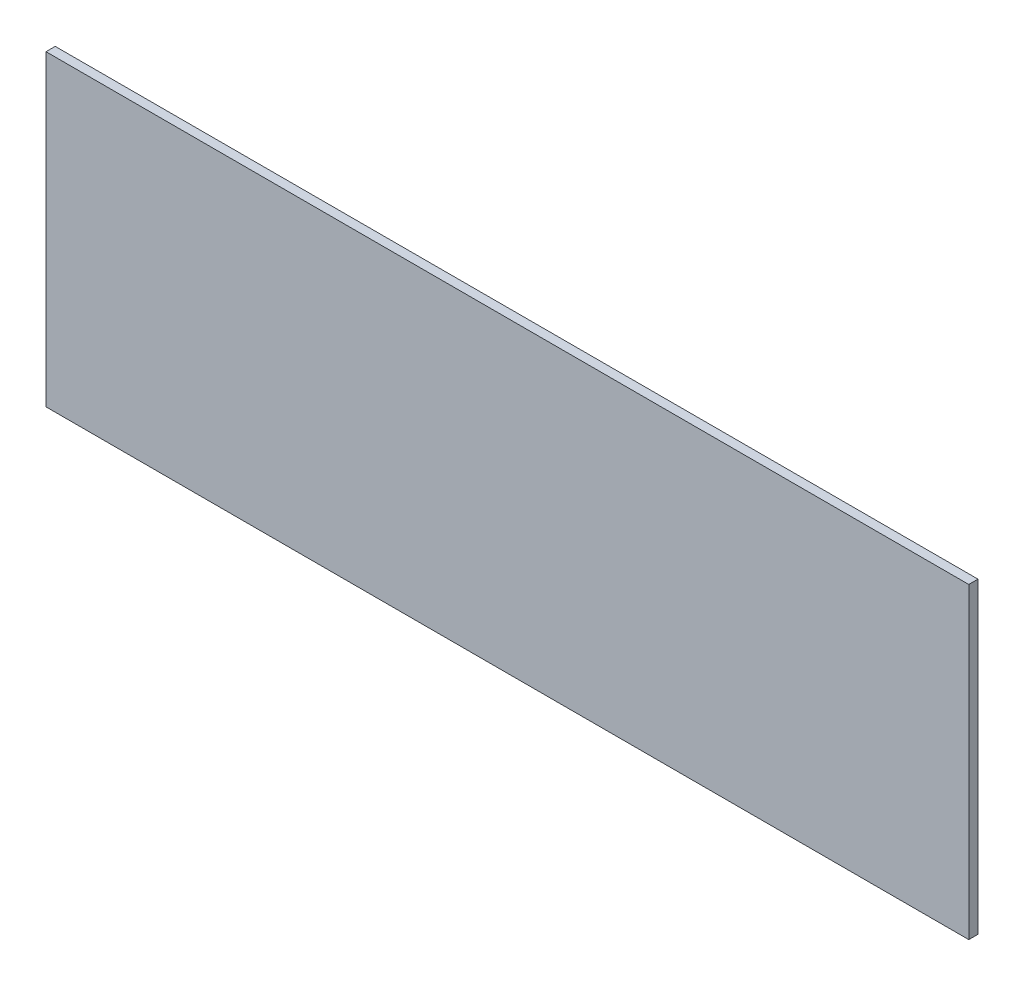
from build123d import *

# Parameters (mm, degrees)
ESBO_O1_W                = 150
ESBO_O1_H                = 50
RESSALTO_EXTRUS_O1_DEPTH = 1.5


with BuildPart() as part:
    # Esboço1 → Ressalto-extrusão1 (new body)
    with BuildSketch(Plane.XY):
        with Locations((75, 25)):
            Rectangle(ESBO_O1_W, ESBO_O1_H)
    extrude(amount=RESSALTO_EXTRUS_O1_DEPTH)


solid = part.part
